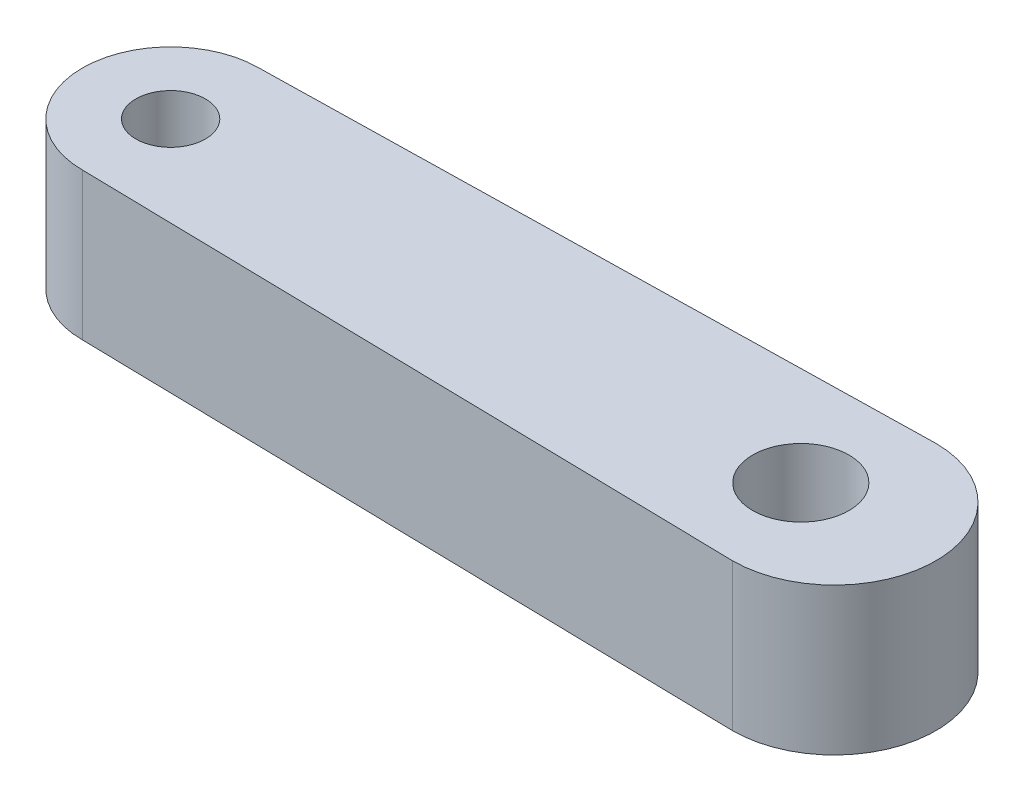
from build123d import *

# Parameters (mm, degrees)
SKETCH1_R           = 6.5
SKETCH1_R_2         = 9
BOSS_EXTRUDE1_DEPTH = 27.5


with BuildPart() as part:
    # Sketch1 → Boss-Extrude1 (new body)
    with BuildSketch(Plane(origin=(0, 0, 0), x_dir=(1, 0, 0), z_dir=(0, 1, 0))):
        with BuildLine():
            ThreePointArc((124, -19), (143, 0), (124, 19))
            Line((124, 19), (123.234182256, 18.984560126))
            Line((123.234182256, 18.984560126), (0, 16.5))
            ThreePointArc((0, 16.5), (-16.5, 0), (0, -16.5))
            Line((0, -16.5), (123.234182256, -18.984560126))
            Line((123.234182256, -18.984560126), (124, -19))
        make_face()
        with Locations(Location((0, 0, 0), (0, 0, 270))):
            Circle(SKETCH1_R, mode=Mode.SUBTRACT)
        with Locations(Location((117.75, 0, 0), (0, 0, 270))):
            Circle(SKETCH1_R_2, mode=Mode.SUBTRACT)
    extrude(amount=BOSS_EXTRUDE1_DEPTH)


solid = part.part
